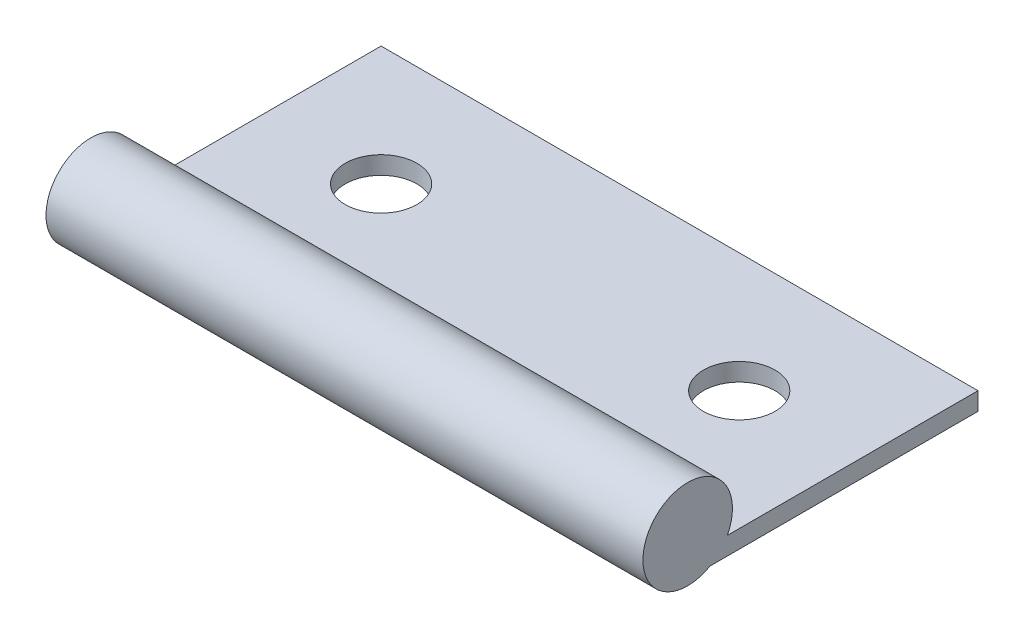
from build123d import *

# Parameters (mm, degrees)
SALIENTE_EXTRUIR1_DEPTH = 50
CROQUIS2_R              = 3
CORTAR_EXTRUIR1_DEPTH   = 50


with BuildPart() as part:
    # Croquis1 → Saliente-Extruir1 (new body)
    with BuildSketch(Plane(origin=(0, 0, 0), x_dir=(0, 0, -1), z_dir=(1, 0, 0))):
        with BuildLine():
            Line((1.870828693, -3.25), (24.31662479, -3.25))
            Line((24.31662479, -3.25), (24.31662479, -1.75))
            Line((24.31662479, -1.75), (3.31662479, -1.75))
            ThreePointArc((3.31662479, -1.75), (-2.699984891, 2.602418411), (1.870828693, -3.25))
        make_face()
    extrude(amount=SALIENTE_EXTRUIR1_DEPTH)

    # Croquis2 → Cortar-Extruir1 (cut)
    with BuildSketch(Plane(origin=(0, -1.75, 0), x_dir=(1, 0, 0), z_dir=(0, 1, 0))):
        with Locations(Location((10, 14.31662479, 0), (0, 0, 270))):
            Circle(CROQUIS2_R)
        with Locations(Location((40, 14.31662479, 0), (0, 0, 270))):
            Circle(CROQUIS2_R)
    extrude(amount=-CORTAR_EXTRUIR1_DEPTH, mode=Mode.SUBTRACT)


solid = part.part
